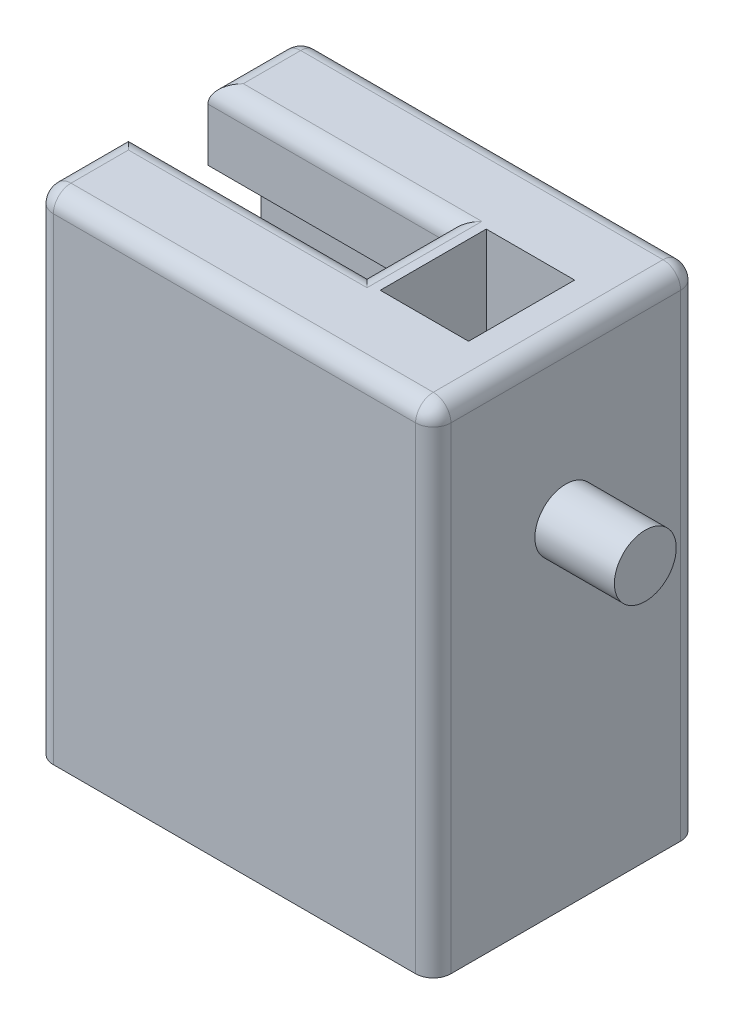
from build123d import *

# Parameters (mm, degrees)
ESQUISSE1_W             = 45
ESQUISSE1_H             = 30
BOSS_EXTRU_1_DEPTH      = 8
ESQUISSE5_W             = 30
ESQUISSE5_H             = 48
BOSS_EXTRU_3_DEPTH      = 45
ENL_V_MAT_EXTRU_1_DEPTH = 27
CONG_1_R                = 2
ESQUISSE16_R            = 3.5
BOSS_EXTRU_5_DEPTH      = 9
D_GAGEMENT_M32_D        = 3.2
D_GAGEMENT_M33_D        = 3.2
D_GAGEMENT_M33_DEPTH    = 8
D_GAGEMENT_M33_TIP      = 0.96137699
ESQUISSE28_W            = 10
ESQUISSE28_H            = 12
ENL_V_MAT_EXTRU_2_DEPTH = 70.045275001


with BuildPart() as part:
    # Esquisse1 → Boss.-Extru.1 (new body)
    with BuildSketch(Plane(origin=(0, 0, 0), x_dir=(1, 0, 0), z_dir=(0, 1, 0))):
        with Locations((6, 0)):
            Rectangle(ESQUISSE1_W, ESQUISSE1_H)
    extrude(amount=BOSS_EXTRU_1_DEPTH)

    # Esquisse5 → Boss.-Extru.3 (add)
    with BuildSketch(Plane.ZY.offset(16.5)):
        with Locations((0, 32)):
            Rectangle(ESQUISSE5_W, ESQUISSE5_H)
    extrude(amount=-BOSS_EXTRU_3_DEPTH)

    # Esquisse6 → Enlèv. mat.-Extru.1 (cut)
    with BuildSketch(Plane.ZY.offset(16.5)):
        Polygon((10.5, 48), (4.5, 48), (4.5, 56), (-4.5, 56), (-4.5, 48), (-10.5, 48), (-10.5, 8), (10.5, 8), align=None)
    extrude(amount=-ENL_V_MAT_EXTRU_1_DEPTH, mode=Mode.SUBTRACT)

    # Congé1
    cong_1_edges = [part.edges().sort_by_distance(p)[0] for p in [
        (6, 56, -15),
        (6, 56, 15),
        (-16.5, 56, 9.75),
        (28.5, 56, 0),
        (-16.5, 56, -9.75),
        (10.5, 56, 0),
        (-3, 56, -4.5),
        (-3, 56, 4.5),
        (28.5, 28, 15),
        (-16.5, 28, 15),
        (-16.5, 28, -15),
        (28.5, 28, -15),
    ]]
    fillet(cong_1_edges, radius=CONG_1_R)

    # Esquisse16 → Boss.-Extru.5 (add)
    with BuildSketch(Plane(origin=(28.5, 0, 0), x_dir=(0, 0, -1), z_dir=(1, 0, 0))):
        with Locations(Location((0, 38, 0), (0, 0, 180))):
            Circle(ESQUISSE16_R)
    extrude(amount=BOSS_EXTRU_5_DEPTH)

    # Dégagement M32 (through all)
    with Locations(Plane(origin=(0, 8, 0), x_dir=(1, 0, 0), z_dir=(0, 1, 0))):
        with Locations((-7.5, 0), (7.5, 0)):
            Hole(D_GAGEMENT_M32_D / 2)

    # Dégagement M33
    with Locations(Plane.ZY.offset(16.5)):
        with Locations((-5, 3.5), (5, 3.5)):
            Hole(D_GAGEMENT_M33_D / 2, depth=D_GAGEMENT_M33_DEPTH)
            with Locations((0, 0, -(D_GAGEMENT_M33_DEPTH + D_GAGEMENT_M33_TIP / 2))):  # 118° drill point
                Cone(0, D_GAGEMENT_M33_D / 2, D_GAGEMENT_M33_TIP, mode=Mode.SUBTRACT)

    # Esquisse28 → Enlèv. mat.-Extru.2 (cut, through all)
    with BuildSketch(Plane(origin=(0, 56, 0), x_dir=(1, 0, 0), z_dir=(0, 1, 0))):
        with Locations((18.5, 0)):
            Rectangle(ESQUISSE28_W, ESQUISSE28_H)
    extrude(amount=-ENL_V_MAT_EXTRU_2_DEPTH, mode=Mode.SUBTRACT)


solid = part.part
